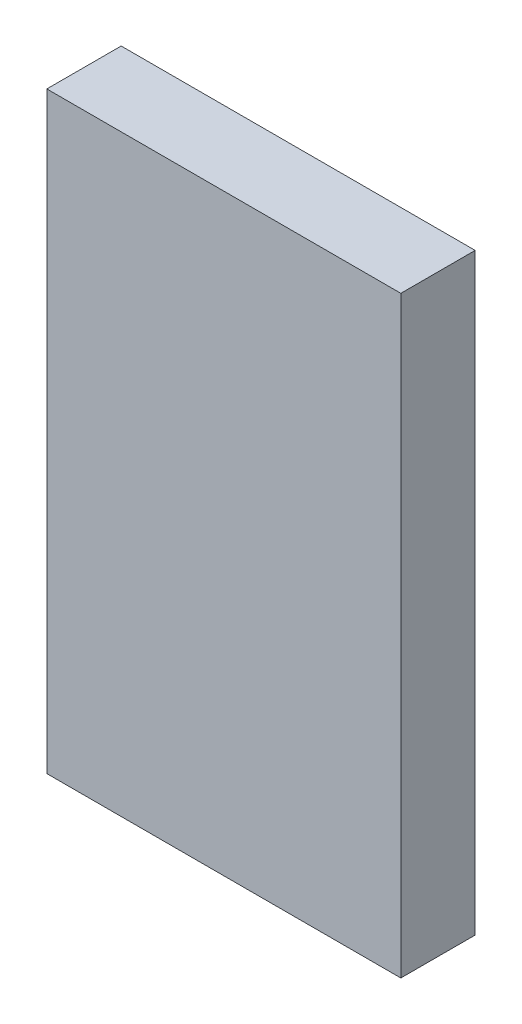
from build123d import *

# Parameters (mm, degrees)
SKETCH_1_W      = 20
SKETCH_1_H      = 33.5
EXTRUDE_1_DEPTH = 4.2


with BuildPart() as part:
    # 草图1 → 凸台-拉伸1 (new body)
    with BuildSketch(Plane.XY):
        with Locations((2.307692308, -11.980769231)):
            Rectangle(SKETCH_1_W, SKETCH_1_H)
    extrude(amount=EXTRUDE_1_DEPTH)


solid = part.part
